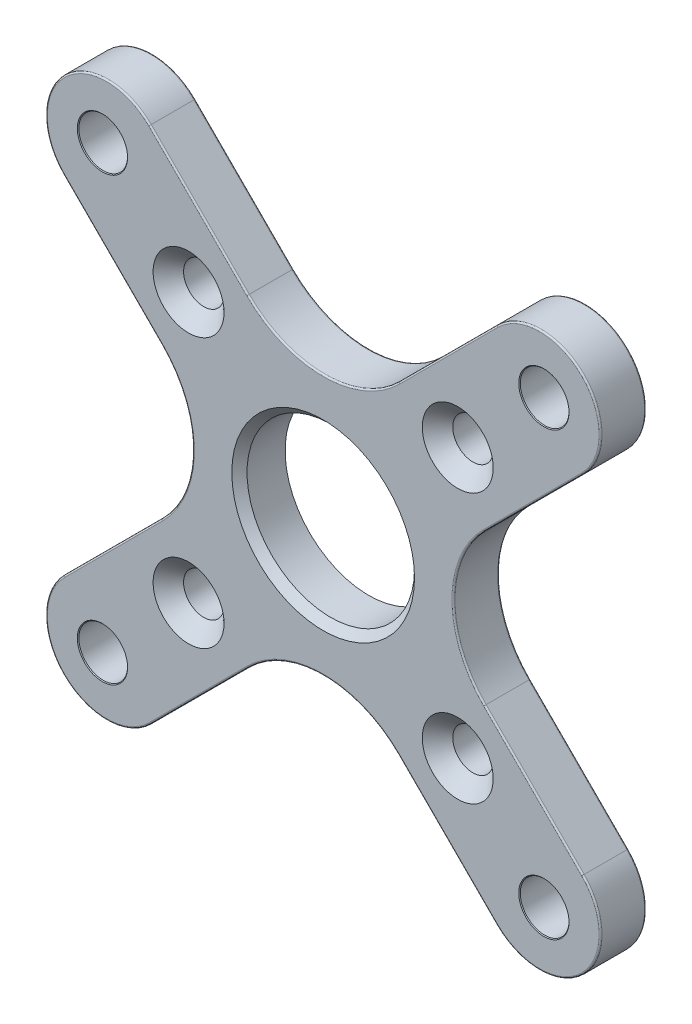
from build123d import *

# Parameters (mm, degrees)
SKETCH1_R                  = 1.3295
SKETCH1_R_2                = 7.25
BOSS_EXTRUDE1_DEPTH        = 3
F_3_2_3_2_DIAMETER_HOLE1_D = 3.2
CHAMFER1_SIZE              = 1
BOSS_EXTRUDE2_START        = -3
SKETCH7_R                  = 7.25
SKETCH7_R_2                = 5.5
BOSS_EXTRUDE2_DEPTH        = 3
CHAMFER2_SIZE              = 0.5
FILLET1_R                  = 0.1
CHAMFER3_SIZE              = 0.05


with BuildPart() as part:
    # Sketch1 → Boss-Extrude1 (new body)
    # profile 1 of 5: a face of its own
    with BuildSketch(Plane.XY):
        with BuildLine():
            Line((-11.388640083, -17.045494333), (-7.594804957, -13.251659206))
            ThreePointArc((-7.594804957, -13.251659206), (-10.800174398, -10.800174398), (-13.251659206, -7.594804957))
            Line((-13.251659206, -7.594804957), (-17.045494333, -11.388640083))
            ThreePointArc((-17.045494333, -11.388640083), (-17.045494333, -17.045494333), (-11.388640083, -17.045494333))
        make_face()
    # profile 2 of 5: a face of its own
    with BuildSketch(Plane.XY):
        with BuildLine():
            Line((-7.026774547, -12.683628797), (-4.949747468, -10.606601718))
            ThreePointArc((-4.949747468, -10.606601718), (0, -8.556349186), (4.949747468, -10.606601718))
            Line((4.949747468, -10.606601718), (7.026774547, -12.683628797))
            Line((7.026774547, -12.683628797), (7.594804957, -13.251659206))
            ThreePointArc((7.594804957, -13.251659206), (10.800174398, -10.800174398), (13.251659206, -7.594804957))
            Line((13.251659206, -7.594804957), (12.683628797, -7.026774547))
            Line((12.683628797, -7.026774547), (10.606601718, -4.949747468))
            ThreePointArc((10.606601718, -4.949747468), (8.556349186, 0), (10.606601718, 4.949747468))
            Line((10.606601718, 4.949747468), (12.683628797, 7.026774547))
            Line((12.683628797, 7.026774547), (13.251659206, 7.594804957))
            ThreePointArc((13.251659206, 7.594804957), (10.800174398, 10.800174398), (7.594804957, 13.251659206))
            Line((7.594804957, 13.251659206), (7.026774547, 12.683628797))
            Line((7.026774547, 12.683628797), (4.949747468, 10.606601718))
            ThreePointArc((4.949747468, 10.606601718), (0, 8.556349186), (-4.949747468, 10.606601718))
            Line((-4.949747468, 10.606601718), (-7.026774547, 12.683628797))
            Line((-7.026774547, 12.683628797), (-7.594804957, 13.251659206))
            ThreePointArc((-7.594804957, 13.251659206), (-10.800174398, 10.800174398), (-13.251659206, 7.594804957))
            Line((-13.251659206, 7.594804957), (-12.683628797, 7.026774547))
            Line((-12.683628797, 7.026774547), (-10.606601718, 4.949747468))
            ThreePointArc((-10.606601718, 4.949747468), (-8.556349186, 0), (-10.606601718, -4.949747468))
            Line((-10.606601718, -4.949747468), (-12.683628797, -7.026774547))
            Line((-12.683628797, -7.026774547), (-13.251659206, -7.594804957))
            ThreePointArc((-13.251659206, -7.594804957), (-10.800174398, -10.800174398), (-7.594804957, -13.251659206))
            Line((-7.594804957, -13.251659206), (-7.026774547, -12.683628797))
        make_face()
        with Locations((-8.838834765, -8.838834765)):
            Circle(SKETCH1_R, mode=Mode.SUBTRACT)
        with Locations((8.838834765, -8.838834765)):
            Circle(SKETCH1_R, mode=Mode.SUBTRACT)
        Circle(SKETCH1_R_2, mode=Mode.SUBTRACT)
        with Locations((-8.838834765, 8.838834765)):
            Circle(SKETCH1_R, mode=Mode.SUBTRACT)
        with Locations((8.838834765, 8.838834765)):
            Circle(SKETCH1_R, mode=Mode.SUBTRACT)
    # profile 3 of 5: a face of its own
    with BuildSketch(Plane.XY):
        with BuildLine():
            ThreePointArc((13.251659206, -7.594804957), (10.800174398, -10.800174398), (7.594804957, -13.251659206))
            Line((7.594804957, -13.251659206), (11.388640083, -17.045494333))
            ThreePointArc((11.388640083, -17.045494333), (17.045494333, -17.045494333), (17.045494333, -11.388640083))
            Line((17.045494333, -11.388640083), (13.251659206, -7.594804957))
        make_face()
    # profile 4 of 5: a face of its own
    with BuildSketch(Plane.XY):
        with BuildLine():
            Line((11.388640083, 17.045494333), (7.594804957, 13.251659206))
            ThreePointArc((7.594804957, 13.251659206), (10.800174398, 10.800174398), (13.251659206, 7.594804957))
            Line((13.251659206, 7.594804957), (17.045494333, 11.388640083))
            ThreePointArc((17.045494333, 11.388640083), (17.045494333, 17.045494333), (11.388640083, 17.045494333))
        make_face()
    # profile 5 of 5: a face of its own
    with BuildSketch(Plane.XY):
        with BuildLine():
            Line((-17.045494333, 11.388640083), (-13.251659206, 7.594804957))
            ThreePointArc((-13.251659206, 7.594804957), (-10.800174398, 10.800174398), (-7.594804957, 13.251659206))
            Line((-7.594804957, 13.251659206), (-11.388640083, 17.045494333))
            ThreePointArc((-11.388640083, 17.045494333), (-17.045494333, 17.045494333), (-17.045494333, 11.388640083))
        make_face()
    extrude(amount=BOSS_EXTRUDE1_DEPTH)

    # Ø3.2 (3.2) Diameter Hole1 (through all)
    with Locations(Plane(origin=(0, 0, 0), x_dir=(-1, 0, 0), z_dir=(0, 0, -1))):
        with Locations((-14.495689014, 14.495689014), (14.495689014, -14.495689014), (14.495689014, 14.495689014), (-14.495689014, -14.495689014)):
            Hole(F_3_2_3_2_DIAMETER_HOLE1_D / 2)

    # Chamfer1
    chamfer1_edges = [part.edges().sort_by_distance(p)[0] for p in [
        (7.509334765, -8.838834765, 3),
        (-10.168334765, -8.838834765, 3),
        (-10.168334765, 8.838834765, 3),
        (7.509334765, 8.838834765, 3),
    ]]
    chamfer(chamfer1_edges, length=CHAMFER1_SIZE)

    # Sketch7 → Boss-Extrude2 (add)
    with BuildSketch(Plane.XY.offset(3).offset(BOSS_EXTRUDE2_START)):
        Circle(SKETCH7_R)
        Circle(SKETCH7_R_2, mode=Mode.SUBTRACT)
    extrude(amount=BOSS_EXTRUDE2_DEPTH)

    # Chamfer2
    chamfer2_edges = [part.edges().sort_by_distance(p)[0] for p in [
        (-5.5, 0, 3),
    ]]
    chamfer(chamfer2_edges, length=CHAMFER2_SIZE)

    # Fillet1
    fillet1_edges = [part.edges().sort_by_distance(p)[0] for p in [
        (-17.045494333, -17.045494333, 3),
        (-8.169193776, -13.826048025, 3),
        (0, -8.556349186, 3),
        (-8.556349186, 0, 0),
        (-13.826048025, 8.169193776, 0),
        (-17.045494333, 17.045494333, 0),
        (-8.169193776, 13.826048025, 0),
        (0, 8.556349186, 0),
        (8.169193776, 13.826048025, 0),
        (8.169193776, -13.826048025, 3),
        (17.045494333, 17.045494333, 0),
        (13.826048025, 8.169193776, 0),
        (8.556349186, 0, 0),
        (13.826048025, -8.169193776, 0),
        (17.045494333, -17.045494333, 0),
        (8.169193776, -13.826048025, 0),
        (0, -8.556349186, 0),
        (-8.169193776, -13.826048025, 0),
        (-17.045494333, -17.045494333, 0),
        (-13.826048025, -8.169193776, 0),
        (17.045494333, -17.045494333, 3),
        (13.826048025, -8.169193776, 3),
        (8.556349186, 0, 3),
        (13.826048025, 8.169193776, 3),
        (17.045494333, 17.045494333, 3),
        (8.169193776, 13.826048025, 3),
        (0, 8.556349186, 3),
        (-8.169193776, 13.826048025, 3),
        (-17.045494333, 17.045494333, 3),
        (-13.826048025, 8.169193776, 3),
        (-8.556349186, 0, 3),
        (-13.826048025, -8.169193776, 3),
    ]]
    fillet(fillet1_edges, radius=FILLET1_R)

    # Chamfer3
    chamfer3_edges = [part.edges().sort_by_distance(p)[0] for p in [
        (12.895689014, -14.495689014, 3),
        (-16.095689014, 14.495689014, 3),
        (-16.095689014, -14.495689014, 3),
        (12.895689014, 14.495689014, 3),
    ]]
    chamfer(chamfer3_edges, length=CHAMFER3_SIZE)


solid = part.part
